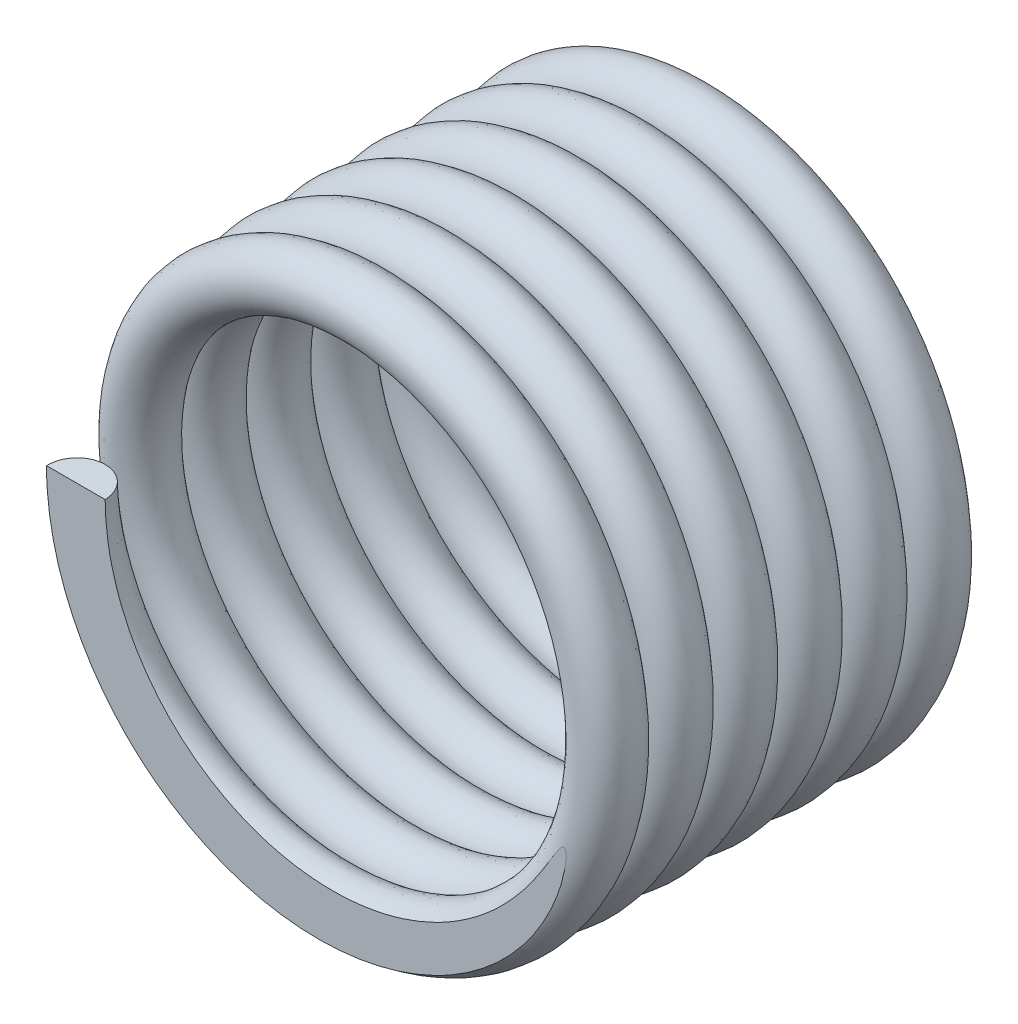
from build123d import *

# Parameters (mm, degrees)
SWEEP_1_PROFILE_R = 1


with BuildPart() as part:
    # По траектории1: sweep along a curve in space
    with BuildLine() as sweep_1_path:
        add(Edge.make_bspline(
            [(-8.5, 0, 0), (-8.5, 4.907477288, 0.183333333), (-4.25, 7.361215932, 0.366666667), (0, 9.814954576, 0.55), (4.25, 7.361215932, 0.733333333), (8.5, 4.907477288, 0.916666667), (8.5, 0, 1.1), (8.5, -4.907477288, 1.283333333), (4.25, -7.361215932, 1.466666667), (0, -9.814954576, 1.65), (-4.25, -7.361215932, 1.833333333), (-8.5, -4.907477288, 2.016666667), (-8.5, 0, 2.2), (-8.5, 4.907477288, 2.383333333), (-4.25, 7.361215932, 2.566666667), (0, 9.814954576, 2.75), (4.25, 7.361215932, 2.933333333), (8.5, 4.907477288, 3.116666667), (8.5, 0, 3.3), (8.5, -4.907477288, 3.483333333), (4.25, -7.361215932, 3.666666667), (0, -9.814954576, 3.85), (-4.25, -7.361215932, 4.033333333), (-8.5, -4.907477288, 4.216666667), (-8.5, 0, 4.4), (-8.5, 4.907477288, 4.583333333), (-4.25, 7.361215932, 4.766666667), (0, 9.814954576, 4.95), (4.25, 7.361215932, 5.133333333), (8.5, 4.907477288, 5.316666667), (8.5, 0, 5.5), (8.5, -4.907477288, 5.683333333), (4.25, -7.361215932, 5.866666667), (0, -9.814954576, 6.05), (-4.25, -7.361215932, 6.233333333), (-8.5, -4.907477288, 6.416666667), (-8.5, 0, 6.6), (-8.5, 4.907477288, 6.783333333), (-4.25, 7.361215932, 6.966666667), (0, 9.814954576, 7.15), (4.25, 7.361215932, 7.333333333), (8.5, 4.907477288, 7.516666667), (8.5, 0, 7.7), (8.5, -4.907477288, 7.883333333), (4.25, -7.361215932, 8.066666667), (0, -9.814954576, 8.25), (-4.25, -7.361215932, 8.433333333), (-8.5, -4.907477288, 8.616666667), (-8.5, 0, 8.8), (-8.5, 4.907477288, 8.983333333), (-4.25, 7.361215932, 9.166666667), (0, 9.814954576, 9.35), (4.25, 7.361215932, 9.533333333), (8.5, 4.907477288, 9.716666667), (8.5, 0, 9.9), (8.5, -4.907477288, 10.083333333), (4.25, -7.361215932, 10.266666667), (0, -9.814954576, 10.45), (-4.25, -7.361215932, 10.633333333), (-8.5, -4.907477288, 10.816666667), (-8.5, 0, 11), (-8.5, 4.907477288, 11.183333333), (-4.25, 7.361215932, 11.366666667), (0, 9.814954576, 11.55), (4.25, 7.361215932, 11.733333333), (8.5, 4.907477288, 11.916666667), (8.5, 0, 12.1), (8.5, -4.907477288, 12.283333333), (4.25, -7.361215932, 12.466666667), (0, -9.814954576, 12.65), (-4.25, -7.361215932, 12.833333333), (-8.5, -4.907477288, 13.016666667), (-8.5, 0, 13.2)],
            knots=[0, 0, 0, 0.027777778, 0.027777778, 0.055555556, 0.055555556, 0.083333333, 0.083333333, 0.111111111, 0.111111111, 0.138888889, 0.138888889, 0.166666667, 0.166666667, 0.194444444, 0.194444444, 0.222222222, 0.222222222, 0.25, 0.25, 0.277777778, 0.277777778, 0.305555556, 0.305555556, 0.333333333, 0.333333333, 0.361111111, 0.361111111, 0.388888889, 0.388888889, 0.416666667, 0.416666667, 0.444444444, 0.444444444, 0.472222222, 0.472222222, 0.5, 0.5, 0.527777778, 0.527777778, 0.555555556, 0.555555556, 0.583333333, 0.583333333, 0.611111111, 0.611111111, 0.638888889, 0.638888889, 0.666666667, 0.666666667, 0.694444444, 0.694444444, 0.722222222, 0.722222222, 0.75, 0.75, 0.777777778, 0.777777778, 0.805555556, 0.805555556, 0.833333333, 0.833333333, 0.861111111, 0.861111111, 0.888888889, 0.888888889, 0.916666667, 0.916666667, 0.944444444, 0.944444444, 0.972222222, 0.972222222, 1, 1, 1], degree=2, weights=[1, 0.866025404, 1, 0.866025404, 1, 0.866025404, 1, 0.866025404, 1, 0.866025404, 1, 0.866025404, 1, 0.866025404, 1, 0.866025404, 1, 0.866025404, 1, 0.866025404, 1, 0.866025404, 1, 0.866025404, 1, 0.866025404, 1, 0.866025404, 1, 0.866025404, 1, 0.866025404, 1, 0.866025404, 1, 0.866025404, 1, 0.866025404, 1, 0.866025404, 1, 0.866025404, 1, 0.866025404, 1, 0.866025404, 1, 0.866025404, 1, 0.866025404, 1, 0.866025404, 1, 0.866025404, 1, 0.866025404, 1, 0.866025404, 1, 0.866025404, 1, 0.866025404, 1, 0.866025404, 1, 0.866025404, 1, 0.866025404, 1, 0.866025404, 1, 0.866025404, 1]))
    # По траектории1 profile (on start of the path) → По траектории1 (sweep)
    with BuildSketch(Plane(origin=(-8.5, 0, 0), x_dir=(0, -0.03733191714700728, 0.9993029210215134), z_dir=(-7.146882642403633e-15, 0.9993029210215134, 0.03733191714700728))):
        Circle(SWEEP_1_PROFILE_R)
    sweep(path=sweep_1_path.line, is_frenet=True)

    # Surface Cut 1
    split(bisect_by=Plane.XY.offset(13.2), keep=Keep.BOTTOM)

    # Surface Cut 2
    split(bisect_by=Plane.XY, keep=Keep.TOP)


solid = part.part
